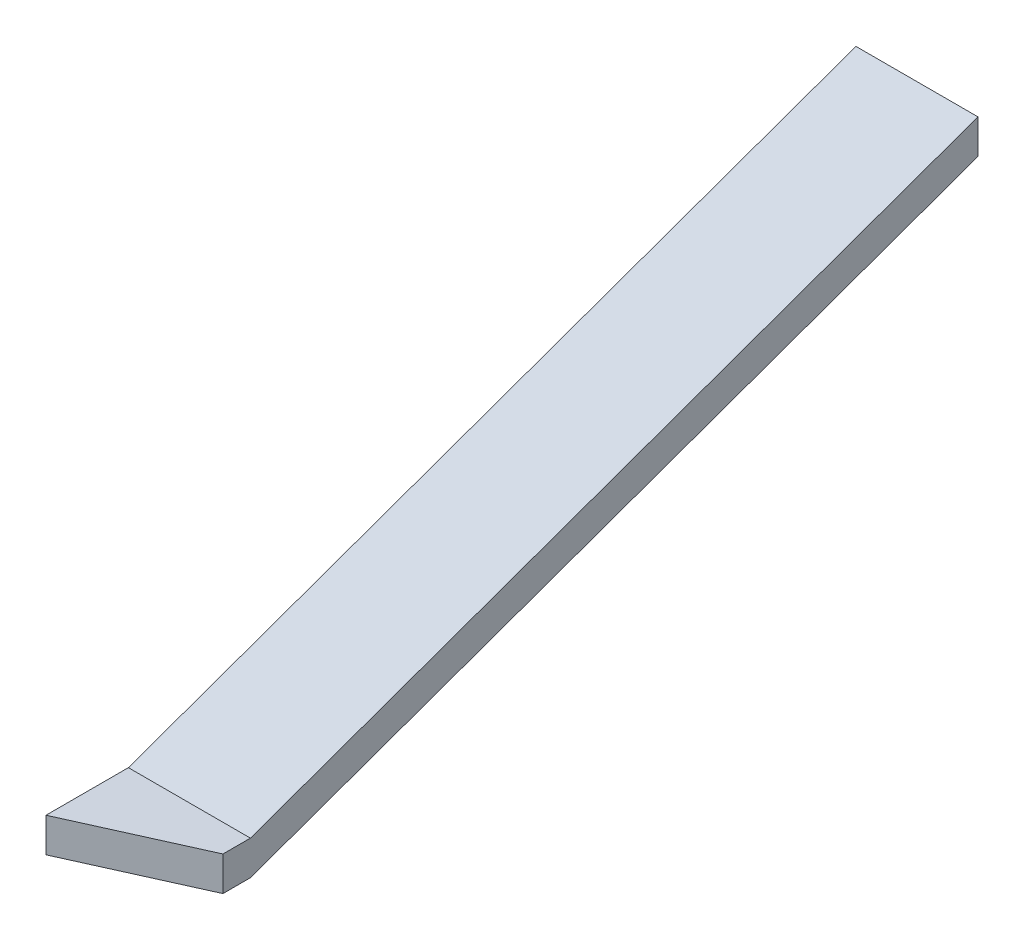
from build123d import *

# Parameters (mm, degrees)
CROQUIS1_W              = 88.9
CROQUIS1_H              = 25
SALIENTE_EXTRUIR1_DEPTH = 60
CROQUIS2_W              = 88.9
CROQUIS2_H              = 25
CORTAR_EXTRUIR1_DEPTH   = 100


with BuildPart() as part:
    # Croquis1 → Saliente-Extruir1 (new body)
    with BuildSketch(Plane.XY):
        with Locations((44.45, 12.5)):
            Rectangle(CROQUIS1_W, CROQUIS1_H)
    extrude(amount=-SALIENTE_EXTRUIR1_DEPTH)

    # Barrer1: sweep along a curve in space
    with BuildLine() as barrer1_path:
        Line((44.45, 202.5, -590), (44.45, 12.5, -60))
    # Croquis2 → Barrer1 (sweep)
    with BuildSketch(Plane(origin=(0, 0, -60), x_dir=(-1, 0, 0), z_dir=(0, 0, -1))):
        with Locations((-44.45, 12.5)):
            Rectangle(CROQUIS2_W, CROQUIS2_H)
    sweep(path=barrer1_path.line)

    # Croquis3 → Cortar-Extruir1 (cut)
    with BuildSketch(Plane(origin=(0, 25, 0), x_dir=(1, 0, 0), z_dir=(0, 1, 0))):
        Polygon((0, 0), (88.9, 40), (88.9, 0), align=None)
    extrude(amount=-CORTAR_EXTRUIR1_DEPTH, mode=Mode.SUBTRACT)


solid = part.part
